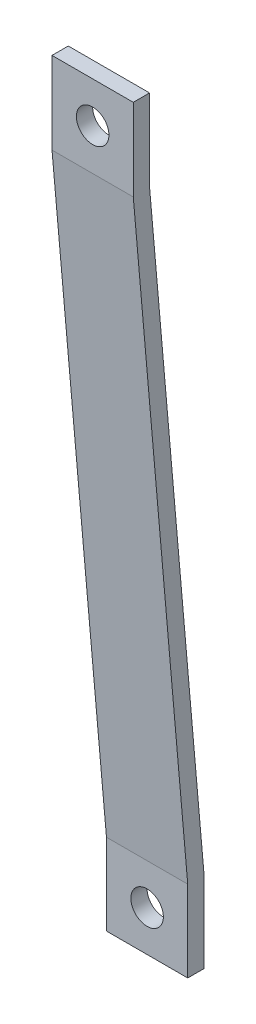
from build123d import *

# Parameters (mm, degrees)
BOSS_EXTRUDE1_DEPTH = 15
SKETCH3_R           = 3
CUT_EXTRUDE1_DEPTH  = 3
SKETCH4_R           = 3
CUT_EXTRUDE2_DEPTH  = 3


with BuildPart() as part:
    # Sketch2 → Boss-Extrude1 (new body)
    with BuildSketch(Plane(origin=(0, 0, 0), x_dir=(0, 0, -1), z_dir=(1, 0, 0))):
        Polygon((-10.049736793, 145), (-10.049736793, 130), (0, 15.130982829), (0, 0), (-3, 0), (-3, 15), (-13.049736793, 129.869017171), (-13.049736793, 145), align=None)
    extrude(amount=BOSS_EXTRUDE1_DEPTH)

    # Sketch3 → Cut-Extrude1 (cut)
    with BuildSketch(Plane.XY.offset(3)):
        with Locations((7.5, 7.5)):
            Circle(SKETCH3_R)
    extrude(amount=-CUT_EXTRUDE1_DEPTH, mode=Mode.SUBTRACT)

    # Sketch4 → Cut-Extrude2 (cut)
    with BuildSketch(Plane.XY.offset(13.049736793)):
        with Locations((7.5, 137.5)):
            Circle(SKETCH4_R)
    extrude(amount=-CUT_EXTRUDE2_DEPTH, mode=Mode.SUBTRACT)


solid = part.part
